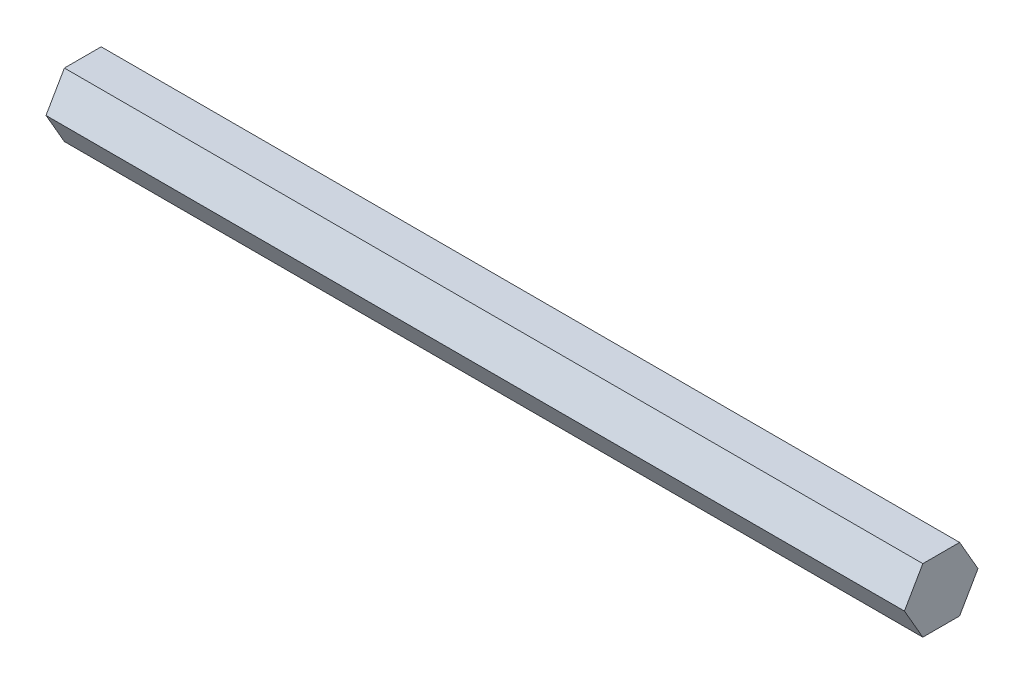
from build123d import *

# Parameters (mm, degrees)
BOSS_EXTRUDE1_DEPTH = 171.45


with BuildPart() as part:
    # Sketch1 → Boss-Extrude1 (new body)
    with BuildSketch(Plane(origin=(0, 0, 0), x_dir=(0, 0, -1), z_dir=(1, 0, 0))):
        Polygon((7.347013116, 0), (3.673506558, 6.3627), (-3.673506558, 6.3627), (-7.347013116, 0), (-3.673506558, -6.3627), (3.673506558, -6.3627), align=None)
    extrude(amount=BOSS_EXTRUDE1_DEPTH)


solid = part.part
